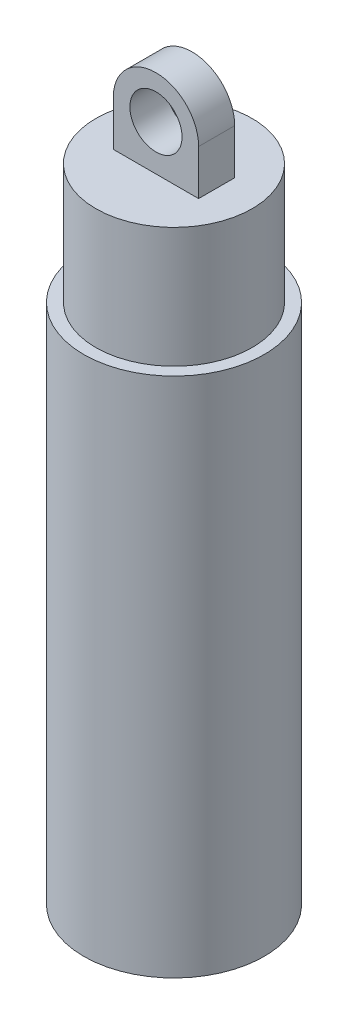
from build123d import *

# Parameters (mm, degrees)
SKETCH_1_R               = 9
EXTRUDE_1_DEPTH          = 52
SKETCH_2_R               = 7.8
EXTRUDE_2_DEPTH          = 12
EXTRUDE_3_DEPTH          = 1.8
EXTRUDE_3_DEPTH_BACK     = 1.8
SKETCH_3_R               = 2.6
EXTRUDE_4_DEPTH          = 1.8
EXTRUDE_4_DEPTH_BACK     = 1.8
SKETCH_4_R               = 1.6
CUT_EXTRUDE_1_DEPTH      = 27
CUT_EXTRUDE_1_DEPTH_BACK = 36
SKETCH_5_R               = 7.5


with BuildPart() as part:
    # 草图1 → 凸台-拉伸1 (new body)
    with BuildSketch(Plane(origin=(0, 0, 0), x_dir=(1, 0, 0), z_dir=(0, 1, 0))):
        Circle(SKETCH_1_R)
    extrude(amount=EXTRUDE_1_DEPTH)

    # 草图2 → 凸台-拉伸2 (add)
    with BuildSketch(Plane(origin=(0, 52, 0), x_dir=(1, 0, 0), z_dir=(0, 1, 0))):
        Circle(SKETCH_2_R)
    extrude(amount=EXTRUDE_2_DEPTH)

    # 草图3 → 凸台-拉伸3 (add, two sides: drawn at the far end of the back side and taken through both)
    with BuildSketch(Plane.XY.offset(-EXTRUDE_3_DEPTH_BACK)):
        with BuildLine():
            Line((-4.255, 68.5), (-4.255, 59.5))
            Line((-4.255, 59.5), (4.255, 59.5))
            Line((4.255, 59.5), (4.255, 68.5))
            ThreePointArc((4.255, 68.5), (0, 72.755), (-4.255, 68.5))
        make_face()
        with Locations((0, 68.5)):
            Circle(SKETCH_3_R, mode=Mode.SUBTRACT)
    extrude(amount=EXTRUDE_3_DEPTH + EXTRUDE_3_DEPTH_BACK)

    # 草图4 → 凸台-拉伸4 (add, two sides: drawn at the far end of the back side and taken through both)
    with BuildSketch(Plane.XY.offset(-EXTRUDE_4_DEPTH_BACK)):
        with BuildLine():
            Line((-4.65, -16.5), (-4.65, -8.5))
            Line((-4.65, -8.5), (-4.65, 0))
            Line((-4.65, 0), (4.65, 0))
            Line((4.65, 0), (4.65, -8.5))
            Line((4.65, -8.5), (4.65, -16.5))
            ThreePointArc((4.65, -16.5), (0, -21.15), (-4.65, -16.5))
        make_face()
        with Locations((0, -16.5)):
            Circle(SKETCH_4_R, mode=Mode.SUBTRACT)
    extrude(amount=EXTRUDE_4_DEPTH + EXTRUDE_4_DEPTH_BACK)

    # 草图5 → 切除-拉伸1 (cut, two sides: drawn at the far end of the back side and taken through both)
    with BuildSketch(Plane.XZ.offset(-CUT_EXTRUDE_1_DEPTH_BACK)):
        Circle(SKETCH_5_R)
    extrude(amount=CUT_EXTRUDE_1_DEPTH + CUT_EXTRUDE_1_DEPTH_BACK, mode=Mode.SUBTRACT)


solid = part.part
